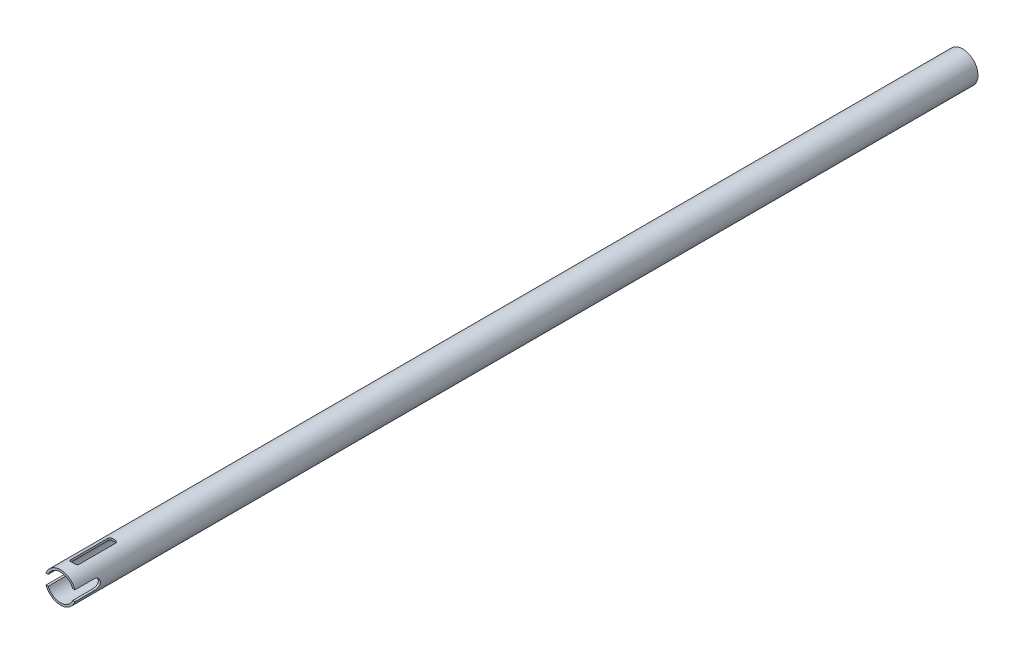
from build123d import *

# Parameters (mm, degrees)
SKETCH1_R               = 4.7625
SKETCH1_R_2             = 4.1275
SHAFTBODY_DEPTH         = 280
SIDECUTS_DEPTH          = 281.080993308
SIDECUTS_DEPTH_BACK     = 281.080993308
CUT_EXTRUDE2_REACH      = 282.081
CUT_EXTRUDE2_END_RADIUS = 4.7625


with BuildPart() as part:
    # Sketch1 → ShaftBody (new body)
    with BuildSketch(Plane.XY):
        Circle(SKETCH1_R)
        Circle(SKETCH1_R_2, mode=Mode.SUBTRACT)
    extrude(amount=-SHAFTBODY_DEPTH)

    # Sketch6 → SideCuts (cut, two sides: drawn at the far end of the back side and taken through both)
    with BuildSketch(Plane(origin=(0, 0, 0), x_dir=(0, 0, -1), z_dir=(1, 0, 0)).offset(-SIDECUTS_DEPTH_BACK)):
        with BuildLine():
            Line((6.0325, 1.5875), (0, 1.5875))
            Line((0, 1.5875), (0, -1.5875))
            Line((0, -1.5875), (6.0325, -1.5875))
            ThreePointArc((6.0325, -1.5875), (7.62, 0), (6.0325, 1.5875))
        make_face()
    extrude(amount=SIDECUTS_DEPTH + SIDECUTS_DEPTH_BACK, mode=Mode.SUBTRACT)

    # Cut-Extrude2: up to this cylinder (the profile starts inside it)
    cut_extrude2_end = Plane(origin=(0, 0, -10.16), z_dir=(0, 0, 1)) * Cylinder(CUT_EXTRUDE2_END_RADIUS, 574.687, mode=Mode.PRIVATE)
    # Sketch7 → Cut-Extrude2 (cut, up to the surface)
    with BuildSketch(Plane(origin=(0, 0, 0), x_dir=(1, 0, 0), z_dir=(0, 1, 0)), mode=Mode.PRIVATE) as cut_extrude2_sk1:
        with BuildLine():
            Line((-0.635, 3.81), (0.635, 3.81))
            ThreePointArc((0.635, 3.81), (1.084012806, 3.995987194), (1.27, 4.445))
            Line((1.27, 4.445), (1.27, 15.875))
            ThreePointArc((1.27, 15.875), (1.084012806, 16.324012806), (0.635, 16.51))
            Line((0.635, 16.51), (-0.635, 16.51))
            ThreePointArc((-0.635, 16.51), (-1.084012806, 16.324012806), (-1.27, 15.875))
            Line((-1.27, 15.875), (-1.27, 4.445))
            ThreePointArc((-1.27, 4.445), (-1.084012806, 3.995987194), (-0.635, 3.81))
        make_face()
    cut_extrude2_tool1 = extrude(cut_extrude2_sk1.sketch, amount=CUT_EXTRUDE2_REACH, mode=Mode.PRIVATE) & cut_extrude2_end
    add(cut_extrude2_tool1.solids().sort_by_distance((0, 0, -10.16))[0], mode=Mode.SUBTRACT)


solid = part.part
